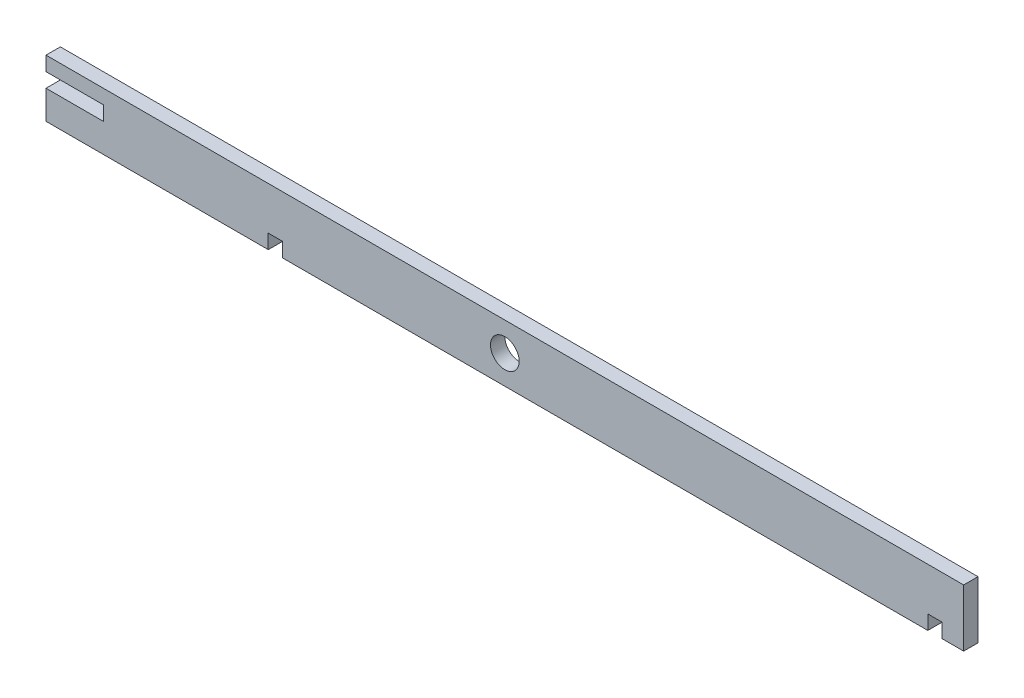
from build123d import *

# Parameters (mm, degrees)
SKETCH2_R           = 3.175
BOSS_EXTRUDE1_DEPTH = 3.175


with BuildPart() as part:
    # Sketch2 → Boss-Extrude1 (new body)
    with BuildSketch(Plane.XY):
        Polygon((0, -12.7), (0, 0), (-203.2, 0), (-203.2, -3.175), (-190.5, -3.175), (-190.5, -6.35), (-203.2, -6.35), (-203.2, -12.7), (-153.9875, -12.7), (-153.9875, -9.525), (-150.8125, -9.525), (-150.8125, -12.7), (-7.9375, -12.7), (-7.9375, -9.525), (-4.7625, -9.525), (-4.7625, -12.7), align=None)
        with Locations((-101.6, -6.35)):
            Circle(SKETCH2_R, mode=Mode.SUBTRACT)
    extrude(amount=BOSS_EXTRUDE1_DEPTH)


solid = part.part
